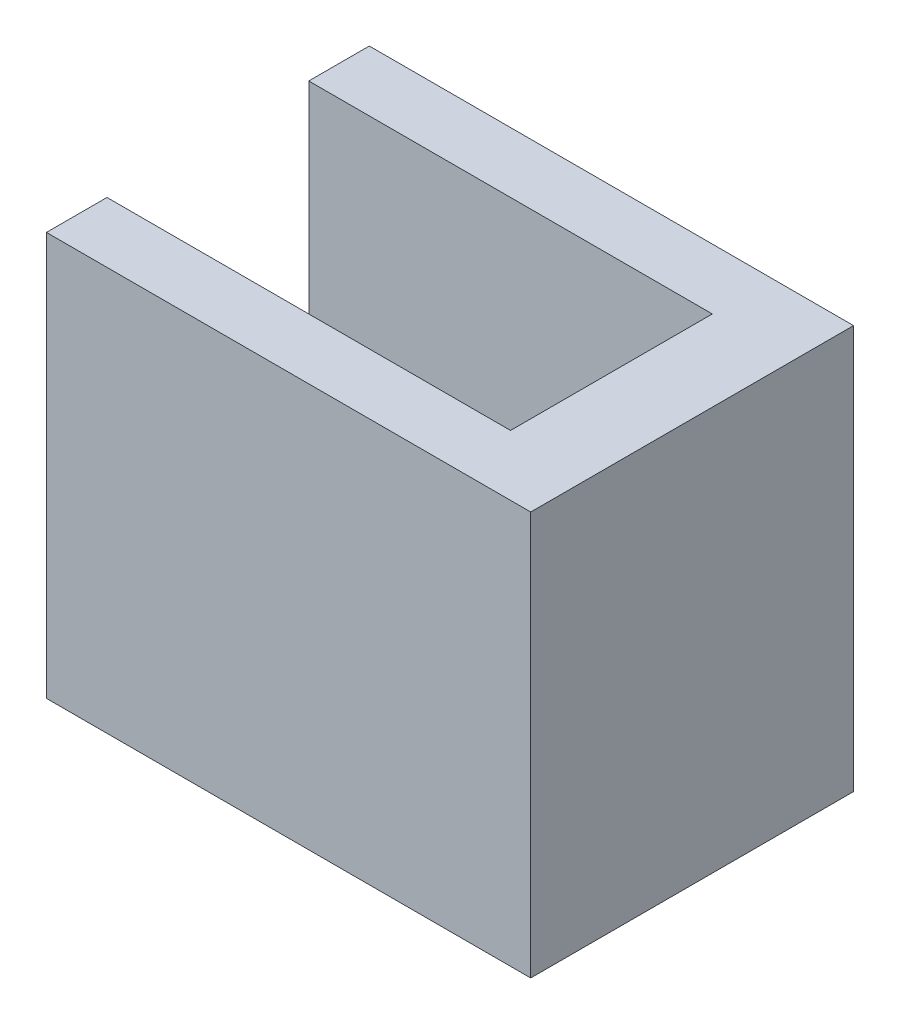
from build123d import *

# Parameters (mm, degrees)
BOSS_EXTRUDE1_DEPTH = 10


with BuildPart() as part:
    # Sketch1 → Boss-Extrude1 (new body)
    with BuildSketch(Plane(origin=(0, 0, 0), x_dir=(1, 0, 0), z_dir=(0, 1, 0))):
        Polygon((-6.739130435, -1.152173913), (-6.739130435, -2.652173913), (5.260869565, -2.652173913), (5.260869565, 5.347826087), (-6.739130435, 5.347826087), (-6.739130435, 3.847826087), (3.260869565, 3.847826087), (3.260869565, -1.152173913), align=None)
    extrude(amount=BOSS_EXTRUDE1_DEPTH)


solid = part.part
